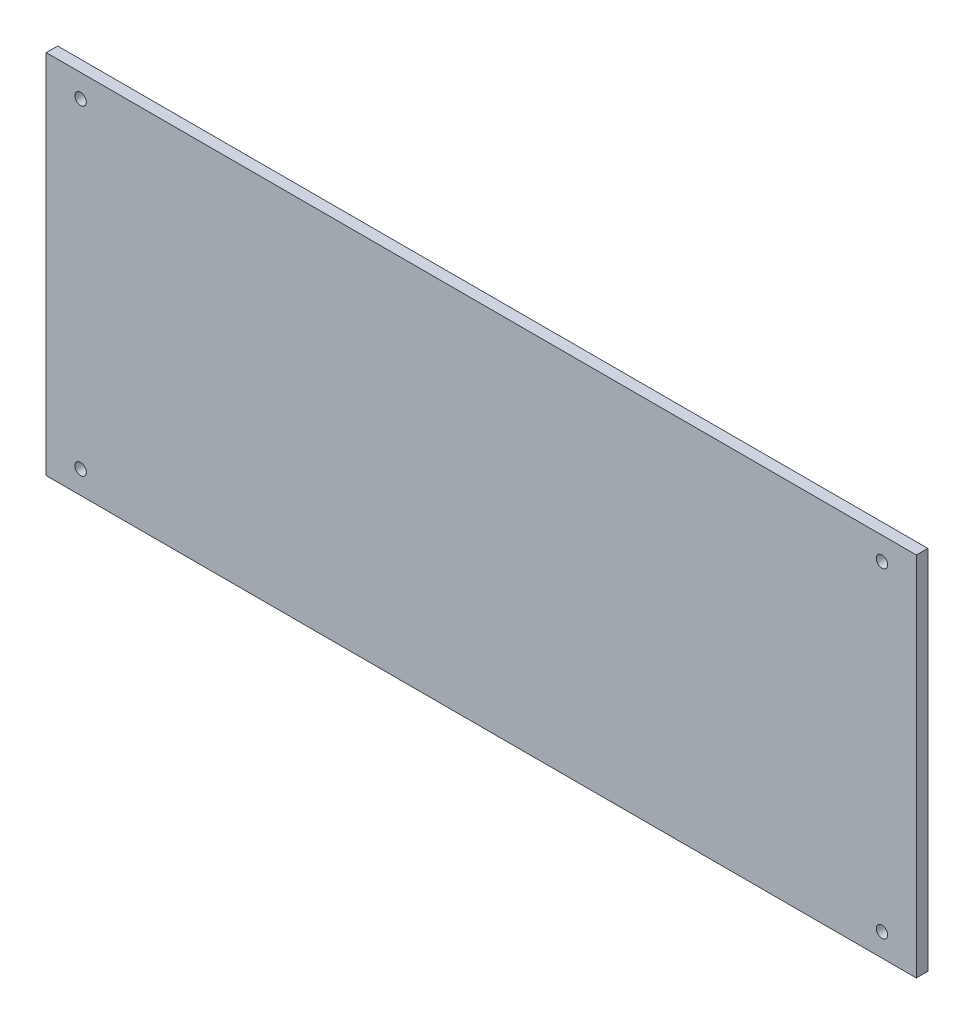
from build123d import *

# Parameters (mm, degrees)
SKETCH1_W                                  = 482.6
SKETCH1_H                                  = 203.2
BOSS_EXTRUDE1_DEPTH                        = 6.35
SKETCH2_R                                  = 3.175
CUT_EXTRUDE1_DEPTH                         = 262.894200967
MIRROR1_AT_THE_SECOND_PLANE_COPY_1_SKETC_R = 3.175
MIRROR1_AT_THE_SECOND_PLANE_COPY_1_DEPTH   = 262.894200967


with BuildPart() as part:
    # Sketch1 → Boss-Extrude1 (new body)
    with BuildSketch(Plane.XY):
        Rectangle(SKETCH1_W, SKETCH1_H)
    extrude(amount=BOSS_EXTRUDE1_DEPTH)

    # Sketch2 → Cut-Extrude1 (cut, through all)
    with BuildSketch(Plane.XY.offset(6.35)):
        with Locations((-222.25, -88.9)):
            Circle(SKETCH2_R)
    cut_extrude1 = extrude(amount=-CUT_EXTRUDE1_DEPTH, mode=Mode.SUBTRACT)

    # Mirror1: Cut-Extrude1 across plane
    add(cut_extrude1.mirror(Plane(origin=(0, 0, 0), x_dir=(0, 0, 1), z_dir=(1, 0, 0))), mode=Mode.SUBTRACT)

    # Mirror1 at the second plane: Cut-Extrude1 across plane
    add(cut_extrude1.mirror(Plane.ZX), mode=Mode.SUBTRACT)

    # Mirror1 at the second plane copy 1 sketc → Mirror1 at the second plane copy 1 (cut, through all)
    with BuildSketch(Plane(origin=(0, 0, 6.35), x_dir=(-1, 0, 0), z_dir=(0, 0, 1))):
        with Locations((-222.25, -88.9)):
            Circle(MIRROR1_AT_THE_SECOND_PLANE_COPY_1_SKETC_R)
    extrude(amount=-MIRROR1_AT_THE_SECOND_PLANE_COPY_1_DEPTH, mode=Mode.SUBTRACT)


solid = part.part
